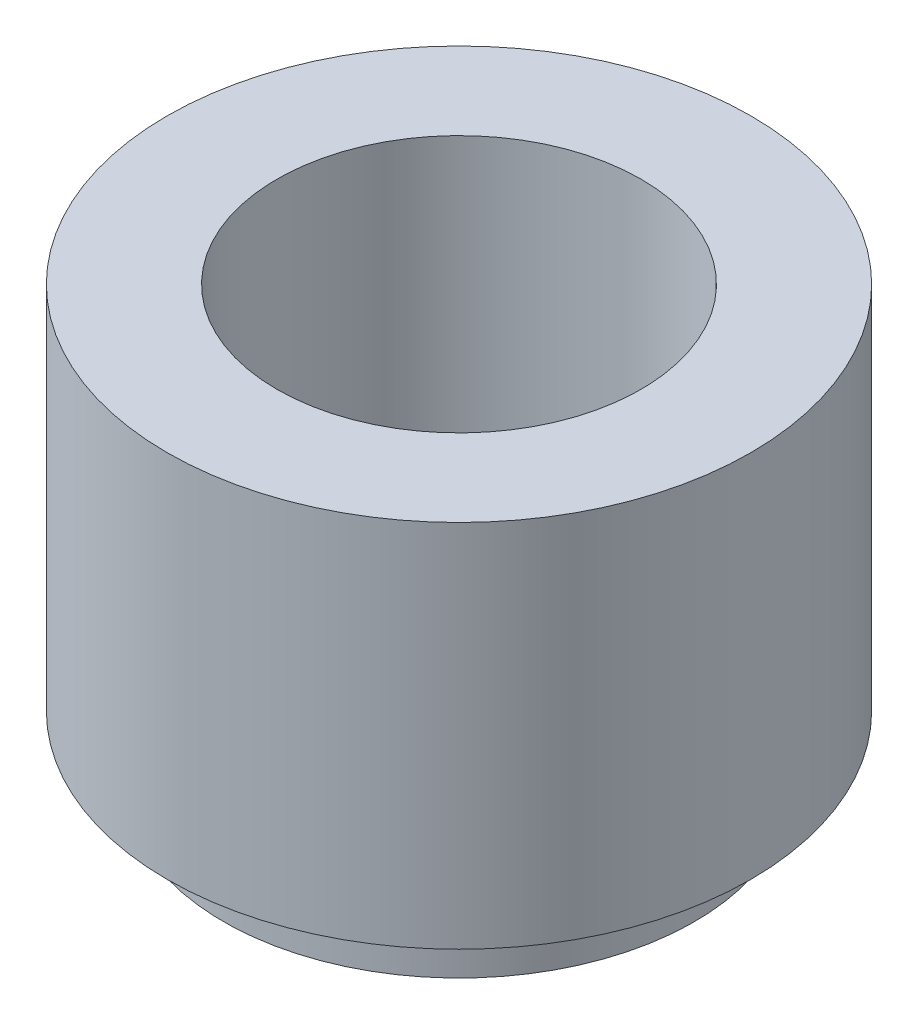
from build123d import *

# Parameters (mm, degrees)
SKETCH1_R                    = 9.525
BOSS_EXTRUDE1_DEPTH          = 5.715
BOSS_EXTRUDE2_DEPTH          = 6.35
SKETCH3_R                    = 7.9375
BOSS_EXTRUDE3_DEPTH          = 1.058333333
SKETCH4_R                    = 7.6835
BOSS_EXTRUDE4_DEPTH          = 1.058333333
F_1_4_18_NPSM_TAPPED_HOLE2_D = 11.8872
SKETCH11_R                   = 10.998522628
SKETCH11_R_2                 = 9.525
CUT_EXTRUDE1_DEPTH           = 21.317795019


with BuildPart() as part:
    # Sketch1 → Boss-Extrude1 (new body)
    with BuildSketch(Plane(origin=(0, 0, 0), x_dir=(1, 0, 0), z_dir=(0, 1, 0))):
        with Locations(Location((0, 0, 0), (0, 0, 270))):
            Circle(SKETCH1_R)
    extrude(amount=BOSS_EXTRUDE1_DEPTH)

    # Sketch2 → Boss-Extrude2 (add)
    with BuildSketch(Plane.XZ):
        Polygon((0, -10.998522628), (9.525, -5.499261314), (9.525, 5.499261314), (0, 10.998522628), (-9.525, 5.499261314), (-9.525, -5.499261314), align=None)
    extrude(amount=BOSS_EXTRUDE2_DEPTH)

    # Sketch3 → Boss-Extrude3 (add)
    with BuildSketch(Plane.XZ.offset(6.35)):
        with Locations(Location((0, 0, 0), (0, 0, 270))):
            Circle(SKETCH3_R)
    extrude(amount=BOSS_EXTRUDE3_DEPTH)

    # Sketch4 → Boss-Extrude4 (add)
    with BuildSketch(Plane.XZ.offset(7.408333333)):
        with Locations(Location((0, 0, 0), (0, 0, 270))):
            Circle(SKETCH4_R)
    extrude(amount=BOSS_EXTRUDE4_DEPTH)

    # 1/4-18 NPSM Tapped Hole2 (through all)
    with Locations(Plane(origin=(0, 5.715, 0), x_dir=(1, 0, 0), z_dir=(0, 1, 0))):
        with Locations((0, 0)):
            Hole(F_1_4_18_NPSM_TAPPED_HOLE2_D / 2)

    # Sketch11 → Cut-Extrude1 (cut, through all)
    with BuildSketch(Plane(origin=(0, 5.715, 0), x_dir=(1, 0, 0), z_dir=(0, 1, 0))):
        Circle(SKETCH11_R)
        with Locations(Location((0, 0, 0), (0, 0, 90))):
            Circle(SKETCH11_R_2, mode=Mode.SUBTRACT)
    extrude(amount=-CUT_EXTRUDE1_DEPTH, mode=Mode.SUBTRACT)


solid = part.part
